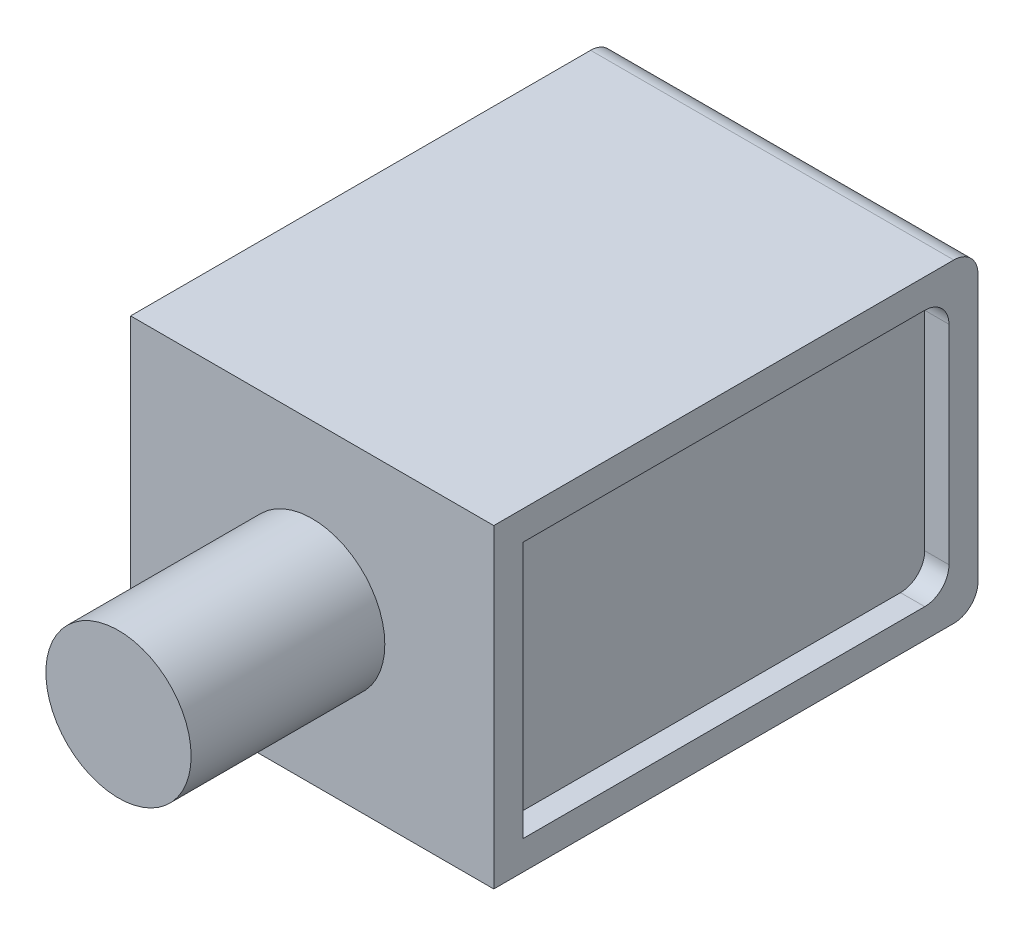
from build123d import *

# Parameters (mm, degrees)
ESQUISSE1_W             = 15
ESQUISSE1_H             = 13
BOSS_EXTRU_1_DEPTH      = 10
CONG_1_R                = 1
ESQUISSE2_W             = 17.6
ESQUISSE2_H             = 10.6
ENL_V_MAT_EXTRU_1_DEPTH = 1
CONG_2_R                = 1
CONG_2_OF_SYM_TRIE1_R   = 1
ESQUISSE3_R             = 3
BOSS_EXTRU_2_DEPTH      = 8


with BuildPart() as part:
    # Esquisse1 → Boss.-Extru.1 (new, symmetric)
    with BuildSketch(Plane.XY):
        Rectangle(ESQUISSE1_W, ESQUISSE1_H)
    extrude(amount=BOSS_EXTRU_1_DEPTH, both=True)

    # Congé1
    cong_1_edges = [part.edges().sort_by_distance(p)[0] for p in [
        (0, 6.5, -10),
        (0, -6.5, -10),
    ]]
    fillet(cong_1_edges, radius=CONG_1_R)

    # Esquisse2 → Enlèv. mat.-Extru.1 (cut)
    with BuildSketch(Plane(origin=(7.5, 0, 0), x_dir=(0, 0, -1), z_dir=(1, 0, 0))):
        Rectangle(ESQUISSE2_W, ESQUISSE2_H)
    enl_v_mat_extru_1 = extrude(amount=-ENL_V_MAT_EXTRU_1_DEPTH, mode=Mode.SUBTRACT)

    # Congé2
    cong_2_edges = [part.edges().sort_by_distance(p)[0] for p in [
        (7, 5.3, -8.8),
        (7, -5.3, -8.8),
    ]]
    fillet(cong_2_edges, radius=CONG_2_R)

    # Symétrie1: Enlèv. mat.-Extru.1 across plane
    add(enl_v_mat_extru_1.mirror(Plane(origin=(0, 0, 0), x_dir=(0, 0, 1), z_dir=(1, 0, 0))), mode=Mode.SUBTRACT)

    # Congé2 of Symétrie1
    cong_2_of_sym_trie1_edges = [part.edges().sort_by_distance(p)[0] for p in [
        (-7, 5.3, -8.8),
        (-7, -5.3, -8.8),
    ]]
    fillet(cong_2_of_sym_trie1_edges, radius=CONG_2_OF_SYM_TRIE1_R)

    # Esquisse3 → Boss.-Extru.2 (add)
    with BuildSketch(Plane.XY.offset(10)):
        Circle(ESQUISSE3_R)
    extrude(amount=BOSS_EXTRU_2_DEPTH)


solid = part.part
